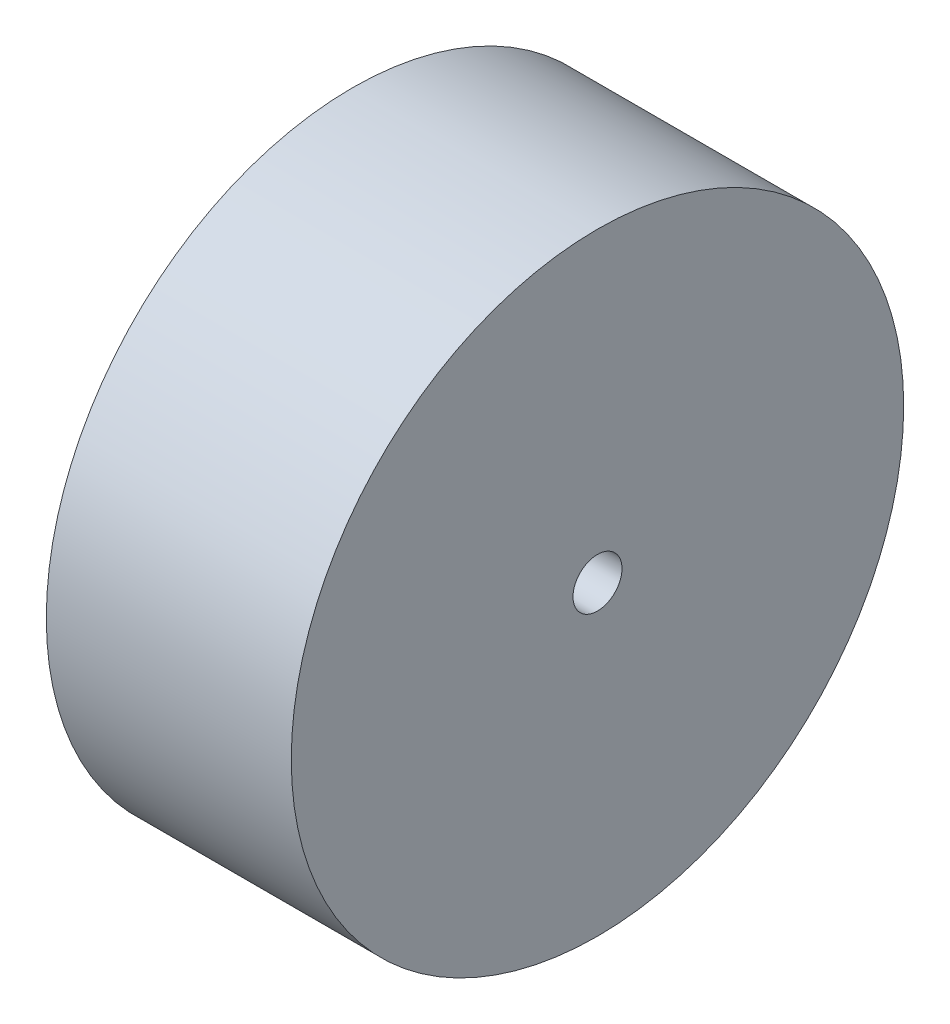
from build123d import *

# Parameters (mm, degrees)
SKETCH1_R           = 62.5
SKETCH1_R_2         = 5
BOSS_EXTRUDE1_DEPTH = 50


with BuildPart() as part:
    # Sketch1 → Boss-Extrude1 (new body)
    with BuildSketch(Plane(origin=(0, 0, 0), x_dir=(0, 0, -1), z_dir=(1, 0, 0))):
        Circle(SKETCH1_R)
        Circle(SKETCH1_R_2, mode=Mode.SUBTRACT)
    extrude(amount=BOSS_EXTRUDE1_DEPTH)


solid = part.part
